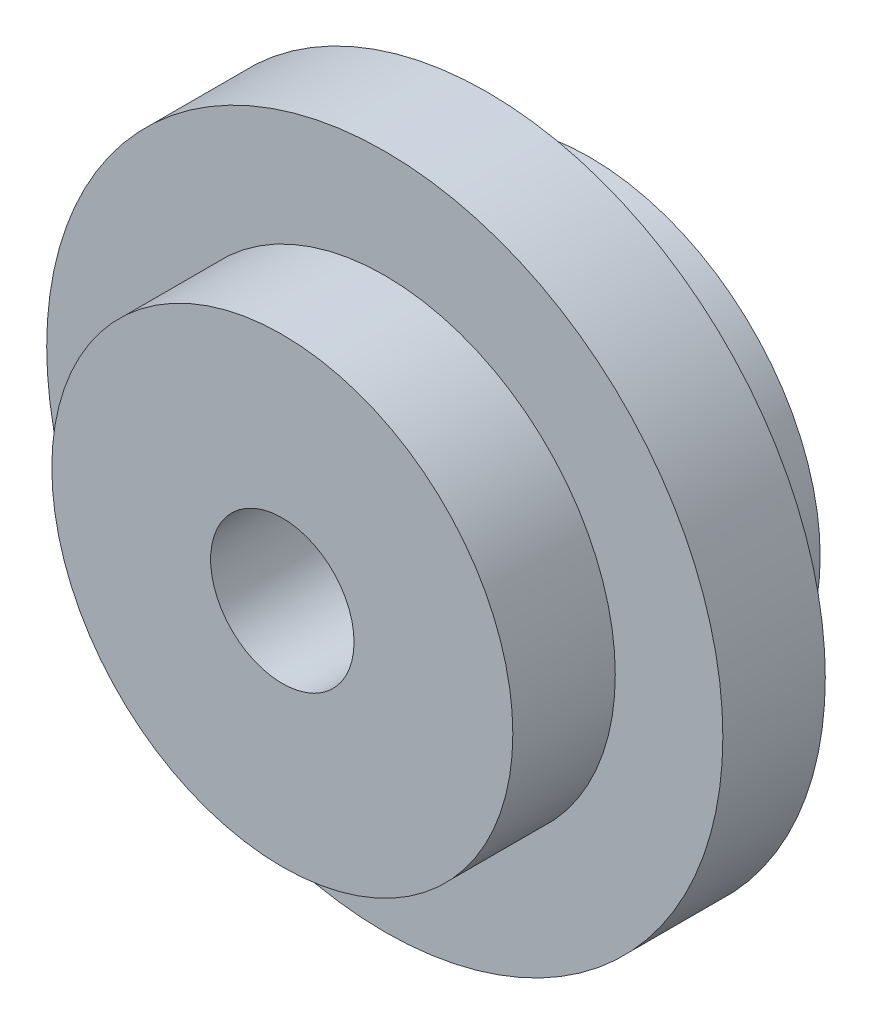
from build123d import *

# Parameters (mm, degrees)
SKETCH1_R                = 6.6
BOSS_EXTRUDE1_DEPTH      = 2
BOSS_EXTRUDE2_DEPTH      = 2
BOSS_EXTRUDE2_DEPTH_BACK = 4
SKETCH2_R                = 4.5
SKETCH8_R                = 1.4
SKETCH6_R                = 1.46


with BuildPart() as part:
    # Sketch1 → Boss-Extrude1 (new body)
    with BuildSketch(Plane.XY.offset(33)):
        Circle(SKETCH1_R)
    extrude(amount=-BOSS_EXTRUDE1_DEPTH)

    # Sketch2 → Boss-Extrude2 (add, two sides: drawn at the far end of the back side and taken through both)
    with BuildSketch(Plane.XY.offset(33).offset(-BOSS_EXTRUDE2_DEPTH_BACK)):
        Circle(SKETCH2_R)
    extrude(amount=BOSS_EXTRUDE2_DEPTH + BOSS_EXTRUDE2_DEPTH_BACK)

    # Sketch8 → Cut-Loft2 section 0
    with BuildSketch(Plane.XY.offset(35)):
        Circle(SKETCH8_R)
    # Sketch6 → Cut-Loft2 section 1
    with BuildSketch(Plane.XY.offset(29)):
        Circle(SKETCH6_R)
    loft(mode=Mode.SUBTRACT)


solid = part.part
